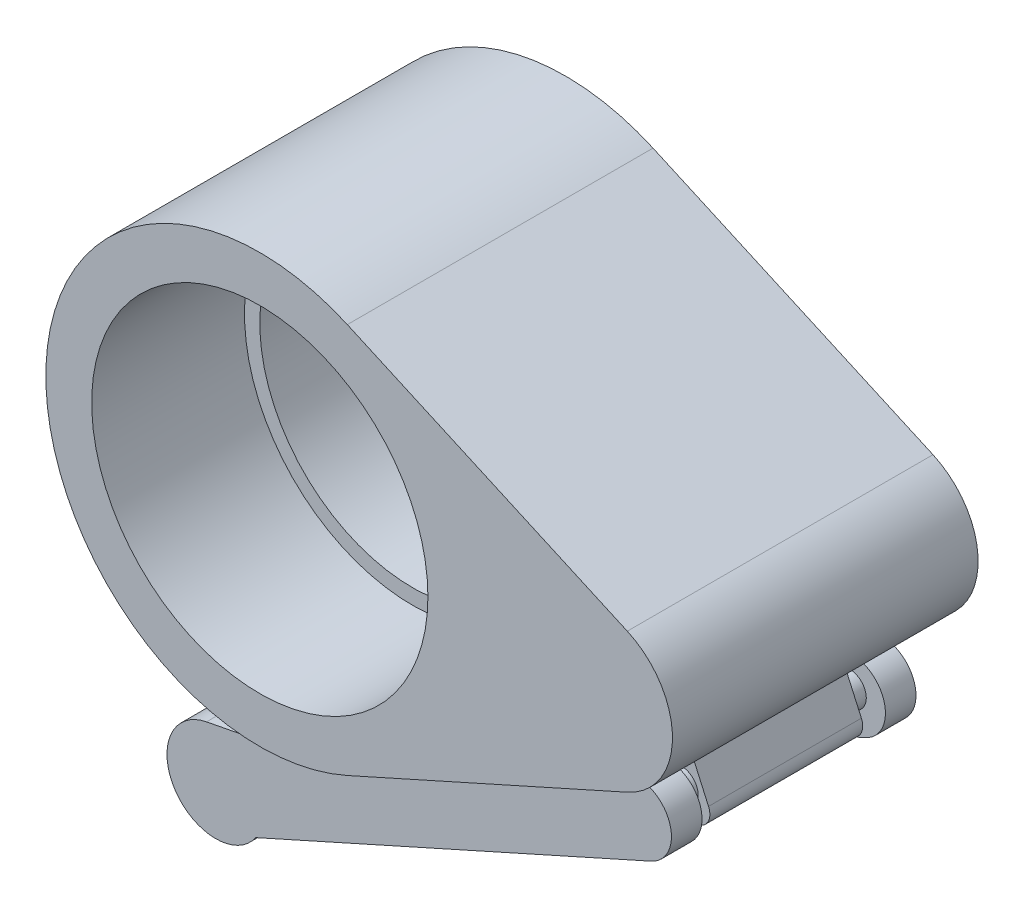
from build123d import *

# Parameters (mm, degrees)
ESQUISSE2_R             = 10
BOSS_EXTRU_1_DEPTH      = 20
ENL_V_START             = -10
ESQUISSE3_R             = 11
ESQUISSE3_R_2           = 10
ENL_V_MAT_EXTRU_1_DEPTH = 10
ESQUISSE4_W             = 3
ESQUISSE4_H             = 10
BOSS_EXTRU_2_DEPTH      = 4
ESQUISSE5_R             = 1.1
BOSS_EXTRU_3_DEPTH      = 1
ESQUISSE9_R             = 1.1
BOSS_EXTRU_5_DEPTH      = 2
BOSS_EXTRU_6_START      = -6
BOSS_EXTRU_6_DEPTH      = 8
CONG_1_R                = 1
CONG_2_R                = 1


with BuildPart() as part:
    # Esquisse2 → Boss.-Extru.1 (new body)
    with BuildSketch(Plane.XY):
        with BuildLine():
            Line((5.727272727, 12.774910845), (24.045454545, 4.562468159))
            ThreePointArc((24.045454545, 4.562468159), (27, 0), (24.045454545, -4.562468159))
            Line((24.045454545, -4.562468159), (5.727272727, -12.774910845))
            ThreePointArc((5.727272727, -12.774910845), (-14, 0), (5.727272727, 12.774910845))
        make_face()
        Circle(ESQUISSE2_R, mode=Mode.SUBTRACT)
    extrude(amount=BOSS_EXTRU_1_DEPTH)

    # Esquisse3 → Enlèv. mat.-Extru.1 (cut)
    with BuildSketch(Plane.XY.offset(20).offset(ENL_V_START)):
        Circle(ESQUISSE3_R)
        Circle(ESQUISSE3_R_2, mode=Mode.SUBTRACT)
    extrude(amount=ENL_V_MAT_EXTRU_1_DEPTH, mode=Mode.SUBTRACT)

    # Esquisse4 → Boss.-Extru.2 (add)
    with BuildSketch(Plane(origin=(5.727272727, -12.774910845, 0), x_dir=(0.9124936318129423, 0.4090909090909094, 0), z_dir=(0.40909090909090934, -0.9124936318129422, 0))):
        with Locations((17.5748599, 10)):
            Rectangle(ESQUISSE4_W, ESQUISSE4_H)
    extrude(amount=BOSS_EXTRU_2_DEPTH)

    # Esquisse5 → Boss.-Extru.3 (add)
    with BuildSketch(Plane.XY.offset(15)):
        with Locations(Location((22.582402284, -7.410182695, 0), (0, 0, 180))):
            Circle(ESQUISSE5_R)
    boss_extru_3 = extrude(amount=BOSS_EXTRU_3_DEPTH)

    # Symétrie1: Boss.-Extru.3 across plane
    add(boss_extru_3.mirror(Plane.XY.offset(10)))

    # Esquisse9 → Boss.-Extru.5 (add)
    # profile 1 of 2: a face of its own
    with BuildSketch(Plane.XY.offset(16)):
        with BuildLine():
            Line((21.323895477, -10.714144048), (23.605129557, -9.691416775))
            ThreePointArc((23.605129557, -9.691416775), (24.737785683, -6.717851558), (21.764220466, -5.585195432))
            Line((21.764220466, -5.585195432), (19.482986386, -6.607922705))
            Line((19.482986386, -6.607922705), (21.323895477, -10.714144048))
        make_face()
        with Locations(Location((22.582402284, -7.410182695, 0), (0, 0, 180))):
            Circle(ESQUISSE9_R, mode=Mode.SUBTRACT)
    # profile 2 of 2: a face of its own
    with BuildSketch(Plane.XY.offset(16)):
        with Locations(Location((22.582402284, -7.410182695, 0), (0, 0, 180))):
            Circle(ESQUISSE9_R)
    boss_extru_5 = extrude(amount=BOSS_EXTRU_5_DEPTH)

    # Esquisse9<4> → Boss.-Extru.6 (add)
    with BuildSketch(Plane.XY.offset(16).offset(BOSS_EXTRU_6_START)):
        with BuildLine():
            Line((-2.260153649, -21.287390546), (21.323895477, -10.714144048))
            Line((21.323895477, -10.714144048), (19.482986386, -6.607922705))
            Line((19.482986386, -6.607922705), (1.283727254, -14.767049742))
            ThreePointArc((1.283727254, -14.767049742), (0.201847525, -15.178661138), (-0.920349818, -15.462493505))
            Line((-0.920349818, -15.462493505), (-5.484659611, -16.339454049))
            ThreePointArc((-5.484659611, -16.339454049), (-7.55515779, -21.213423405), (-2.260153649, -21.287390546))
        make_face()
    boss_extru_6 = extrude(amount=BOSS_EXTRU_6_DEPTH)

    # Symétrie2: Boss.-Extru.5, Boss.-Extru.6 across plane
    add(boss_extru_5.mirror(Plane.XY.offset(10)))
    add(boss_extru_6.mirror(Plane.XY.offset(10)))

    # Congé1
    cong_1_edges = [part.edges().sort_by_distance(p)[0] for p in [
        (24.76932455, -8.621533595, 10),
    ]]
    fillet(cong_1_edges, radius=CONG_1_R)

    # Congé2
    cong_2_edges = [part.edges().sort_by_distance(p)[0] for p in [
        (22.031843655, -9.848806323, 10),
    ]]
    fillet(cong_2_edges, radius=CONG_2_R)


solid = part.part
